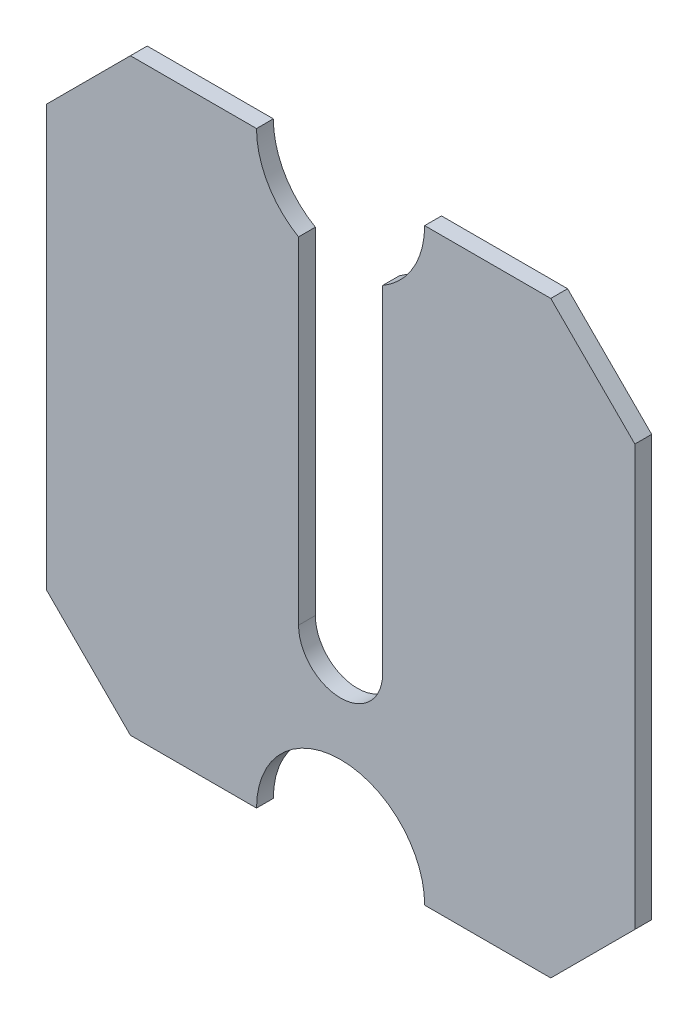
from build123d import *

# Parameters (mm, degrees)
BOSS_EXTRUDE1_DEPTH = 10


with BuildPart() as part:
    # Sketch1 → Boss-Extrude1 (new body)
    with BuildSketch(Plane.XY):
        with BuildLine():
            Line((-25.412459494, 374.587540506), (-100.412459494, 374.587540506))
            ThreePointArc((-100.412459494, 374.587540506), (-107.111189304, 349.587540506), (-125.412459494, 331.286270317))
            Line((-125.412459494, 331.286270317), (-125.412459494, 131.286270317))
            ThreePointArc((-125.412459494, 131.286270317), (-150.412459494, 106.286270317), (-175.412459494, 131.286270317))
            Line((-175.412459494, 131.286270317), (-175.412459494, 331.286270317))
            ThreePointArc((-175.412459494, 331.286270317), (-193.713729683, 349.587540506), (-200.412459494, 374.587540506))
            Line((-200.412459494, 374.587540506), (-275.412459494, 374.587540506))
            Line((-275.412459494, 374.587540506), (-325.412459494, 324.587540506))
            Line((-325.412459494, 324.587540506), (-325.412459494, 74.587540506))
            Line((-325.412459494, 74.587540506), (-275.412459494, 24.587540506))
            Line((-275.412459494, 24.587540506), (-200.412459494, 24.587540506))
            ThreePointArc((-200.412459494, 24.587540506), (-150.412459494, 74.587540506), (-100.412459494, 24.587540506))
            Line((-100.412459494, 24.587540506), (-25.412459494, 24.587540506))
            Line((-25.412459494, 24.587540506), (24.587540506, 74.587540506))
            Line((24.587540506, 74.587540506), (24.587540506, 324.587540506))
            Line((24.587540506, 324.587540506), (-25.412459494, 374.587540506))
        make_face()
    extrude(amount=BOSS_EXTRUDE1_DEPTH)


solid = part.part
